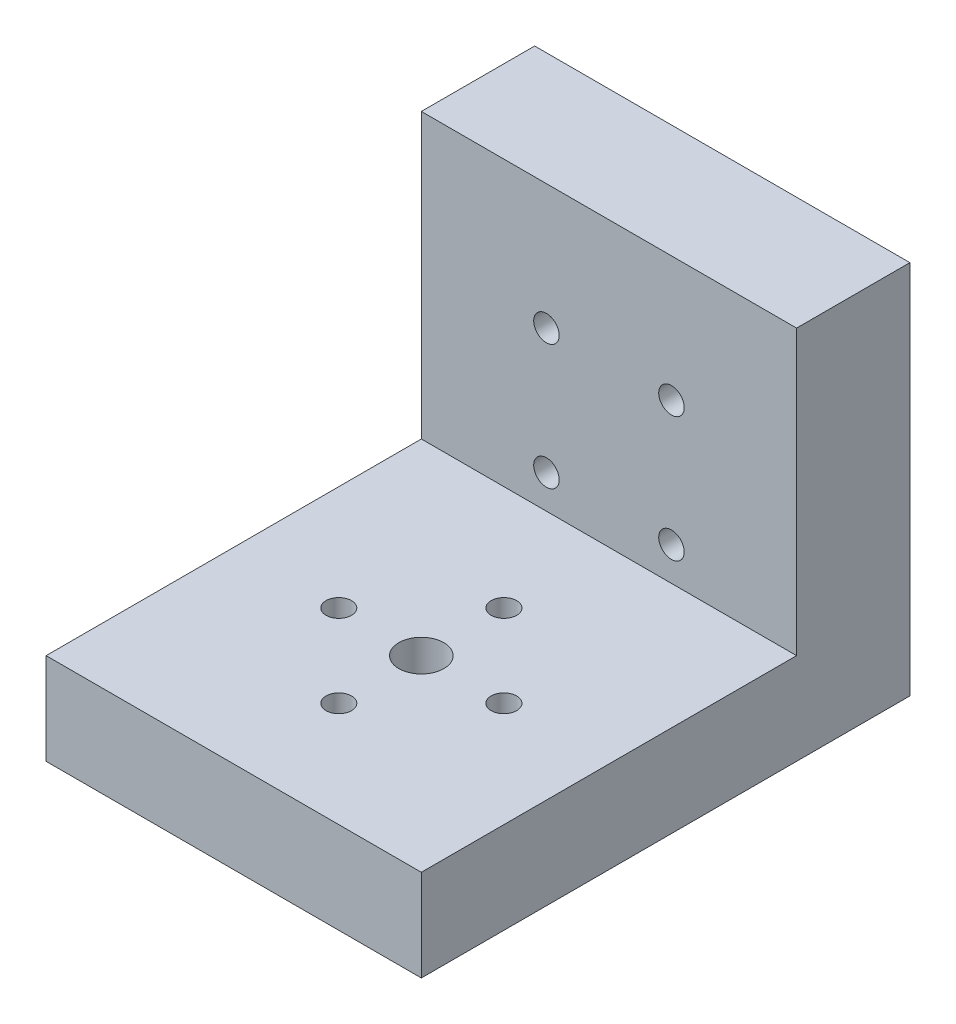
from build123d import *

# Parameters (mm, degrees)
SKETCH2_W           = 50
SKETCH2_H           = 50
BOSS_EXTRUDE1_DEPTH = 15.1
SKETCH3_R           = 1.7
CUT_EXTRUDE1_DEPTH  = 73.304979082
SKETCH4_W           = 50
SKETCH4_H           = 12.2
BOSS_EXTRUDE2_DEPTH = 50
SKETCH5_R           = 3
SKETCH5_R_2         = 1.7
CUT_EXTRUDE2_DEPTH  = 91.370625759


with BuildPart() as part:
    # Sketch2 → Boss-Extrude1 (new body)
    with BuildSketch(Plane(origin=(0, 0, 0), x_dir=(0, 1, 0), z_dir=(0, 0, 1))):
        with Locations((25, -25)):
            Rectangle(SKETCH2_W, SKETCH2_H)
    extrude(amount=BOSS_EXTRUDE1_DEPTH)

    # Sketch3 → Cut-Extrude1 (cut, through all)
    with BuildSketch(Plane.XY.offset(15.1)):
        with Locations((16.67, 33.33)):
            Circle(SKETCH3_R)
        with Locations((33.33, 33.33)):
            Circle(SKETCH3_R)
        with Locations((16.67, 16.67)):
            Circle(SKETCH3_R)
        with Locations((33.33, 16.67)):
            Circle(SKETCH3_R)
    extrude(amount=-CUT_EXTRUDE1_DEPTH, mode=Mode.SUBTRACT)

    # Sketch4 → Boss-Extrude2 (add)
    with BuildSketch(Plane.XY.offset(15.1)):
        with Locations((25, 6.1)):
            Rectangle(SKETCH4_W, SKETCH4_H)
    extrude(amount=BOSS_EXTRUDE2_DEPTH)

    # Sketch5 → Cut-Extrude2 (cut, through all)
    with BuildSketch(Plane(origin=(0, 12.2, 0), x_dir=(-1, 0, 0), z_dir=(0, 1, 0))):
        with Locations(Location((-25, 40.1, 0), (0, 0, 90))):
            Circle(SKETCH5_R)
        with Locations(Location((-36, 40.1, 0), (0, 0, 90))):
            Circle(SKETCH5_R_2)
        with Locations(Location((-25, 51.1, 0), (0, 0, 90))):
            Circle(SKETCH5_R_2)
        with Locations(Location((-14, 40.1, 0), (0, 0, 90))):
            Circle(SKETCH5_R_2)
        with Locations(Location((-25, 29.1, 0), (0, 0, 90))):
            Circle(SKETCH5_R_2)
    extrude(amount=-CUT_EXTRUDE2_DEPTH, mode=Mode.SUBTRACT)


solid = part.part
